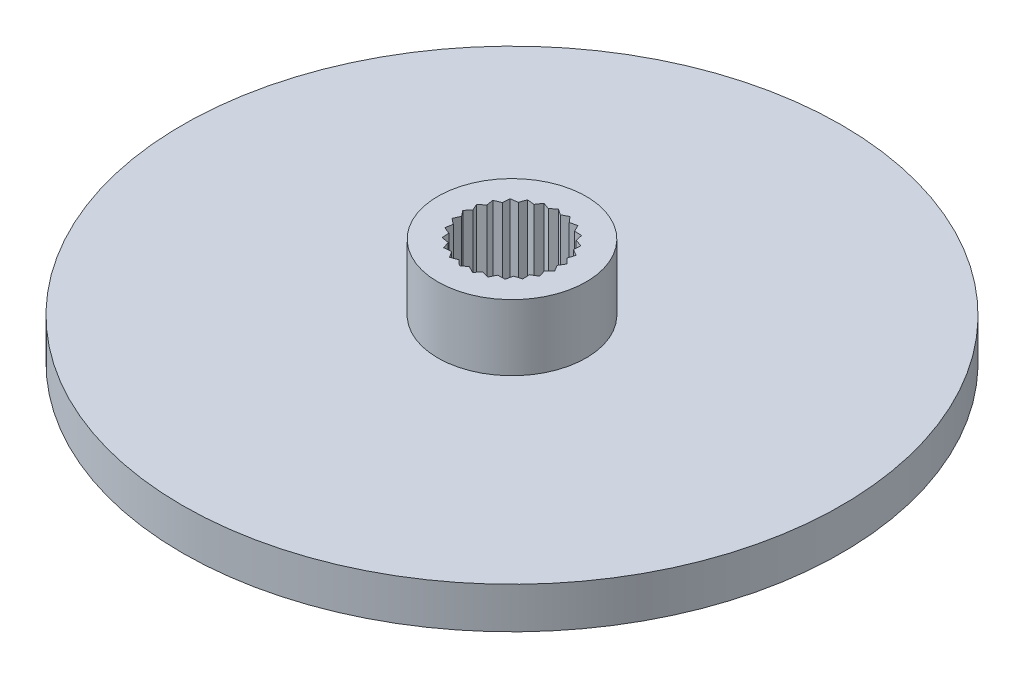
from build123d import *

# Parameters (mm, degrees)
SKETCH2_R               = 20
BOSS_EXTRUDE1_DEPTH     = 2.5
SKETCH3_R               = 4.5
SKETCH3_R_2             = 2.75
BOSS_EXTRUDE2_DEPTH     = 4
CUT_EXTRUDE1_DEPTH      = 29.565713714
CUT_EXTRUDE1_DEPTH_BACK = 29.565713714
SKETCH3_3_R             = 2.75
CUT_EXTRUDE2_DEPTH      = 30.021543722
CIRPATTERN1_COUNT       = 25


with BuildPart() as part:
    # Sketch2 → Boss-Extrude1 (new body)
    with BuildSketch(Plane(origin=(0, 0, 0), x_dir=(1, 0, 0), z_dir=(0, 1, 0))):
        Circle(SKETCH2_R)
    extrude(amount=BOSS_EXTRUDE1_DEPTH)

    # Sketch3 → Boss-Extrude2 (add)
    with BuildSketch(Plane(origin=(0, 2.5, 0), x_dir=(1, 0, 0), z_dir=(0, 1, 0))):
        Circle(SKETCH3_R)
        Circle(SKETCH3_R_2, mode=Mode.SUBTRACT)
    extrude(amount=BOSS_EXTRUDE2_DEPTH)

    # Sketch3<3> → Cut-Extrude1 (cut, two sides: drawn at the far end of the back side and taken through both)
    with BuildSketch(Plane(origin=(0, 2.5, 0), x_dir=(1, 0, 0), z_dir=(0, 1, 0)).offset(-CUT_EXTRUDE1_DEPTH_BACK)):
        Circle(SKETCH3_3_R)
    extrude(amount=CUT_EXTRUDE1_DEPTH + CUT_EXTRUDE1_DEPTH_BACK, mode=Mode.SUBTRACT)

    # Sketch5 → Cut-Extrude2 (cut, symmetric)
    with BuildSketch(Plane(origin=(0, 6.5, 0), x_dir=(1, 0, 0), z_dir=(0, 1, 0))):
        with BuildLine():
            ThreePointArc((0.160191529, -2.74533034), (-0.185152758, -2.743759912), (-0.527577075, -2.698918752))
            Line((-0.527577075, -2.698918752), (-0.201984827, -2.993192632))
            Line((-0.201984827, -2.993192632), (0.160191529, -2.74533034))
        make_face()
    cut_extrude2 = extrude(amount=CUT_EXTRUDE2_DEPTH, both=True, mode=Mode.SUBTRACT)

    # CirPattern1: Cut-Extrude2 ×25 about axis
    cirpattern1_axis = Axis((0, -0.518707645, 0), (0, 1, 0))
    for i in range(1, CIRPATTERN1_COUNT):
        add(cut_extrude2.rotate(cirpattern1_axis, i * 360 / CIRPATTERN1_COUNT), mode=Mode.SUBTRACT)


solid = part.part
